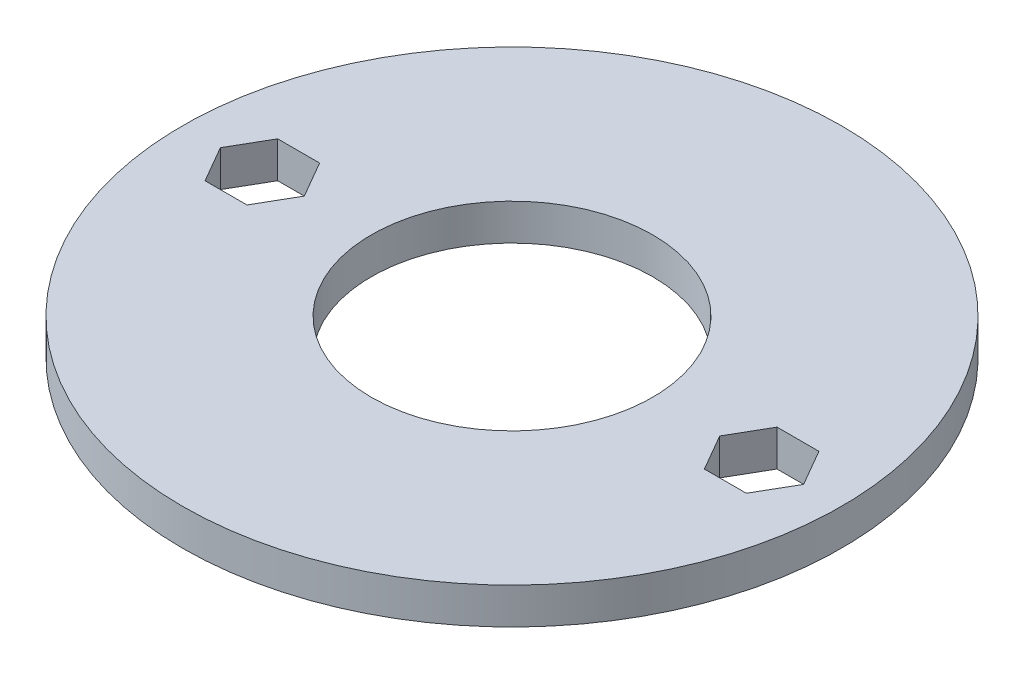
from build123d import *

# Parameters (mm, degrees)
SKETCH1_R           = 36.3
SKETCH1_R_2         = 15.5
BOSS_EXTRUDE1_DEPTH = 4


with BuildPart() as part:
    # Sketch1 → Boss-Extrude1 (new body)
    with BuildSketch(Plane(origin=(0, 0, 0), x_dir=(1, 0, 0), z_dir=(0, 1, 0))):
        with Locations(Location((0, 0, 0), (0, 0, 270))):
            Circle(SKETCH1_R)
        with Locations(Location((0, 0, 0), (0, 0, 270))):
            Circle(SKETCH1_R_2, mode=Mode.SUBTRACT)
        Polygon((25.190598923, -4), (22.881197846, 0), (25.190598923, 4), (29.809401077, 4), (32.118802154, 0), (29.809401077, -4), align=None, mode=Mode.SUBTRACT)
        Polygon((-22.881197846, 0), (-25.190598923, 4), (-29.809401077, 4), (-32.118802154, 0), (-29.809401077, -4), (-25.190598923, -4), align=None, mode=Mode.SUBTRACT)
    extrude(amount=BOSS_EXTRUDE1_DEPTH)


solid = part.part
